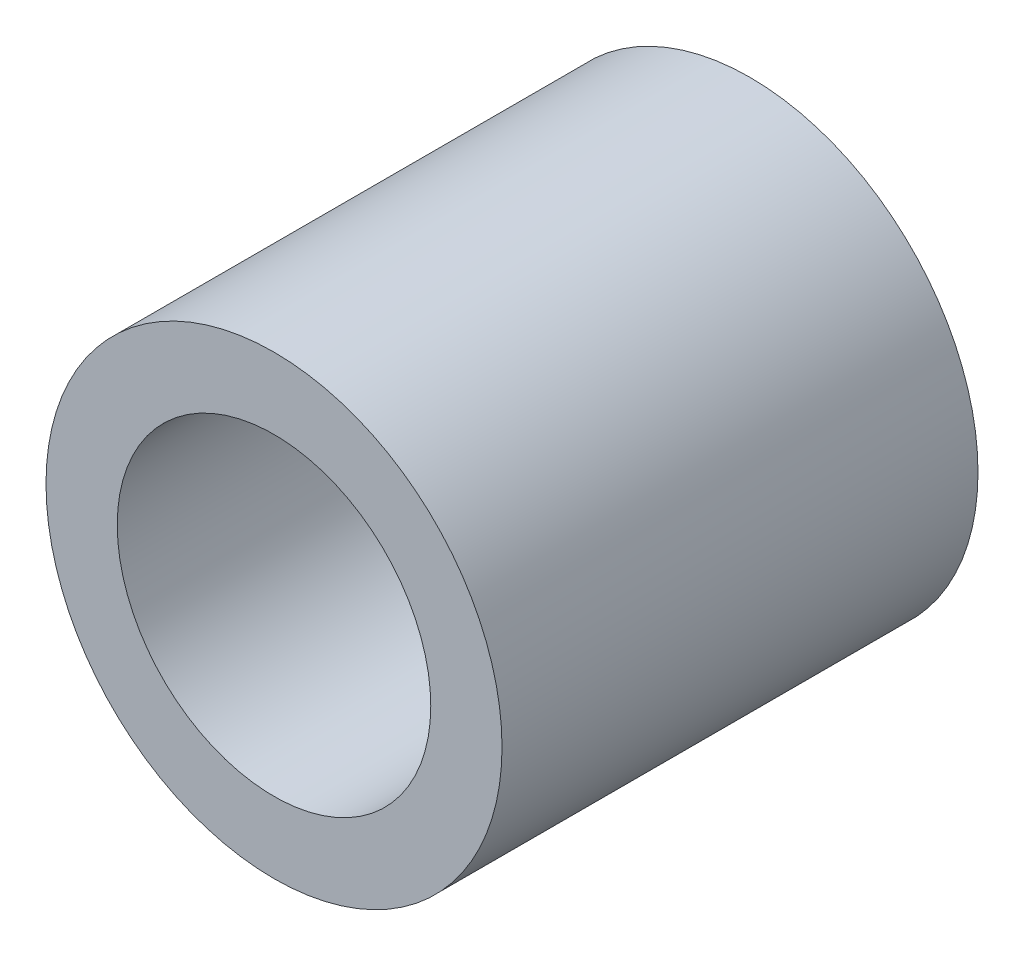
from build123d import *

# Parameters (mm, degrees)
SKETCH1_R           = 4
SKETCH1_R_2         = 2.75
BOSS_EXTRUDE1_DEPTH = 8.35


with BuildPart() as part:
    # Sketch1 → Boss-Extrude1 (new body)
    with BuildSketch(Plane.XY):
        Circle(SKETCH1_R)
        Circle(SKETCH1_R_2, mode=Mode.SUBTRACT)
    extrude(amount=-BOSS_EXTRUDE1_DEPTH)


solid = part.part
